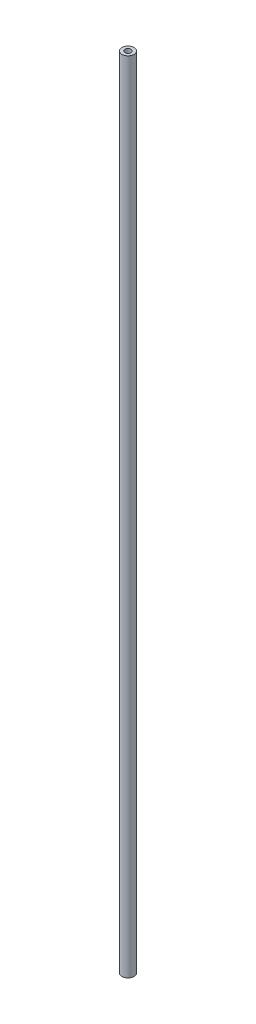
from build123d import *

# Parameters (mm, degrees)
SKETCH1_R           = 6.35
SKETCH1_R_2         = 3.175
BOSS_EXTRUDE1_DEPTH = 841.603219466


with BuildPart() as part:
    # Sketch1 → Boss-Extrude1 (new body)
    with BuildSketch(Plane(origin=(0, 0, 0), x_dir=(-1, 0, 0), z_dir=(0, 1, 0))):
        with Locations(Location((0, 0, 0), (0, 0, 90))):
            Circle(SKETCH1_R)
        with Locations(Location((0, 0, 0), (0, 0, 90))):
            Circle(SKETCH1_R_2, mode=Mode.SUBTRACT)
    extrude(amount=BOSS_EXTRUDE1_DEPTH)


solid = part.part
